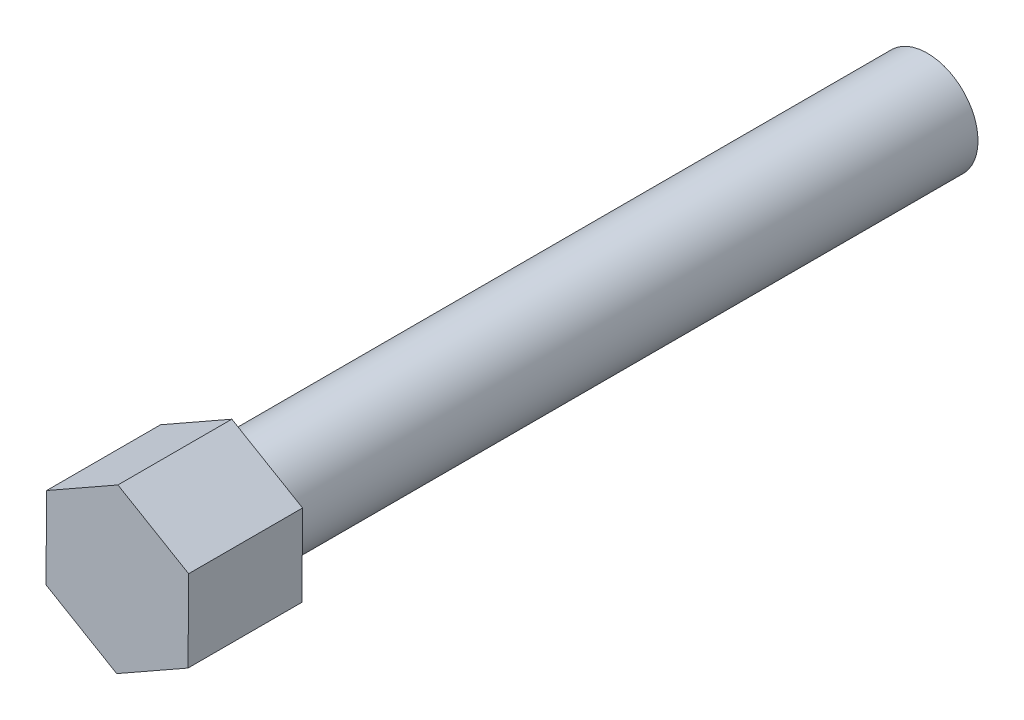
from build123d import *

# Parameters (mm, degrees)
SKETCH_1_R      = 4
EXTRUDE_1_DEPTH = 55
EXTRUDE_2_DEPTH = 9


with BuildPart() as part:
    # 草图1 → 拉伸1 (new body)
    with BuildSketch(Plane.XY):
        Circle(SKETCH_1_R)
    extrude(amount=EXTRUDE_1_DEPTH)

    # 草图2 → 拉伸2 (add)
    with BuildSketch(Plane.XY.offset(55)):
        Polygon((-5.587185355, 3.280549199), (-5.634631622, -3.198369853), (-0.047446267, -6.478919052), (5.587185355, -3.280549199), (5.634631622, 3.198369853), (0.047446267, 6.478919052), align=None)
    extrude(amount=EXTRUDE_2_DEPTH)


solid = part.part
